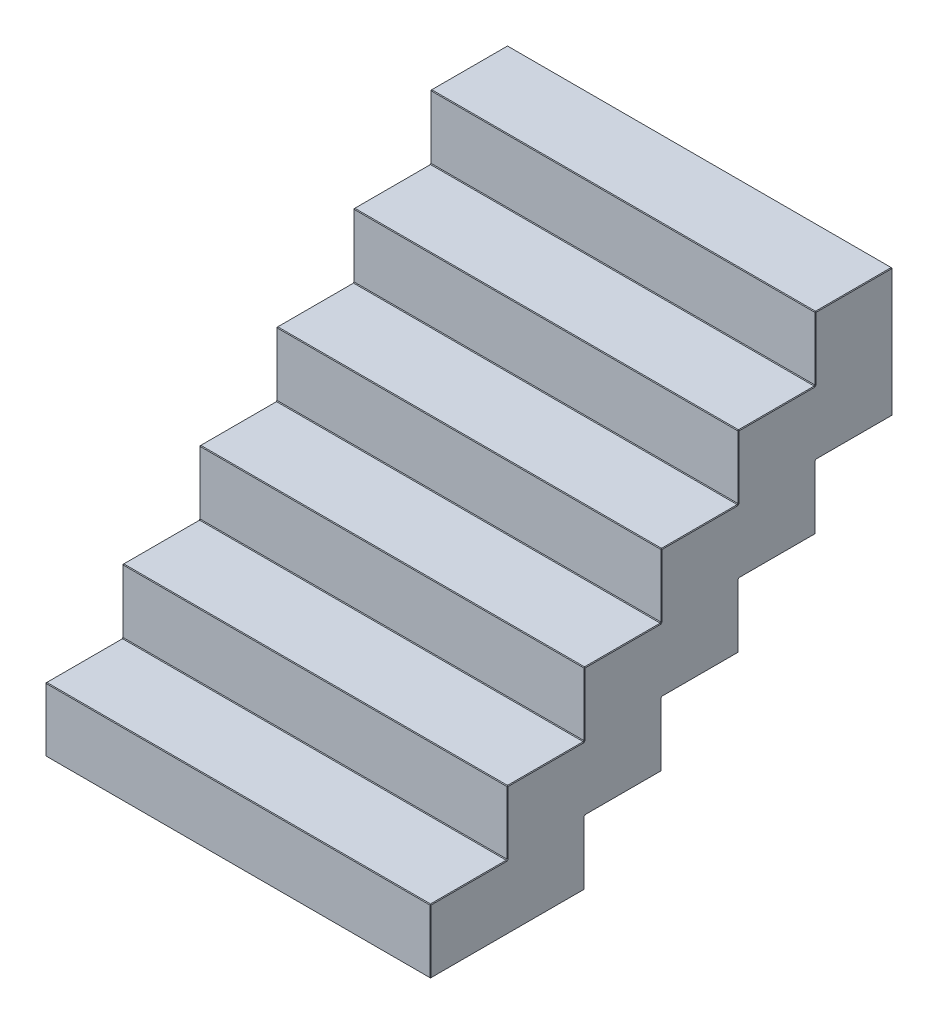
from build123d import *

# Parameters (mm, degrees)
BOSS_EXTRUDE2_DEPTH = 1524
CHAMFER1_SIZE       = 2.54


with BuildPart() as part:
    # Sketch3 → Boss-Extrude2 (new body)
    with BuildSketch(Plane(origin=(0, 0, 0), x_dir=(0, 0, -1), z_dir=(1, 0, 0))):
        Polygon((0, 0), (0, 254), (304.8, 254), (304.8, 508), (609.6, 508), (609.6, 762), (914.4, 762), (914.4, 1016), (1219.2, 1016), (1219.2, 1270), (1524, 1270), (1524, 1524), (1828.8, 1524), (1828.8, 1270), (1828.8, 1016), (1524, 1016), (1524, 762), (1219.2, 762), (1219.2, 508), (914.4, 508), (914.4, 254), (609.6, 254), (609.6, 0), align=None)
    extrude(amount=BOSS_EXTRUDE2_DEPTH)

    # Chamfer1
    chamfer1_edges = [part.edges().sort_by_distance(p)[0] for p in [
        (1524, 254, -762),
        (1524, 381, -914.4),
        (1524, 508, -1066.8),
        (1524, 635, -1219.2),
        (0, 127, 0),
        (0, 254, -152.4),
        (0, 381, -304.8),
        (0, 508, -457.2),
        (0, 635, -609.6),
        (0, 762, -762),
        (1524, 762, -1371.6),
        (0, 889, -914.4),
        (0, 1016, -1066.8),
        (0, 1143, -1219.2),
        (0, 1270, -1371.6),
        (0, 1397, -1524),
        (0, 1524, -1676.4),
        (0, 1270, -1828.8),
        (1524, 889, -1524),
        (0, 1016, -1676.4),
        (0, 889, -1524),
        (0, 762, -1371.6),
        (0, 635, -1219.2),
        (0, 508, -1066.8),
        (0, 381, -914.4),
        (0, 254, -762),
        (1524, 1016, -1676.4),
        (0, 127, -609.6),
        (0, 0, -304.8),
        (1524, 1270, -1828.8),
        (762, 0, 0),
        (762, 254, 0),
        (762, 254, -304.8),
        (762, 508, -304.8),
        (762, 508, -609.6),
        (762, 762, -609.6),
        (762, 762, -914.4),
        (762, 1016, -914.4),
        (762, 1016, -1219.2),
        (762, 1270, -1219.2),
        (762, 1270, -1524),
        (1524, 1524, -1676.4),
        (762, 1524, -1524),
        (762, 1524, -1828.8),
        (762, 1016, -1828.8),
        (762, 1016, -1524),
        (762, 762, -1524),
        (762, 762, -1219.2),
        (762, 508, -1219.2),
        (762, 508, -914.4),
        (762, 254, -914.4),
        (762, 254, -609.6),
        (762, 0, -609.6),
        (1524, 0, -304.8),
        (1524, 1397, -1524),
        (1524, 1270, -1371.6),
        (1524, 1143, -1219.2),
        (1524, 1016, -1066.8),
        (1524, 889, -914.4),
        (1524, 762, -762),
        (1524, 635, -609.6),
        (1524, 508, -457.2),
        (1524, 381, -304.8),
        (1524, 254, -152.4),
        (1524, 127, -609.6),
        (1524, 127, 0),
    ]]
    chamfer(chamfer1_edges, length=CHAMFER1_SIZE)


solid = part.part
